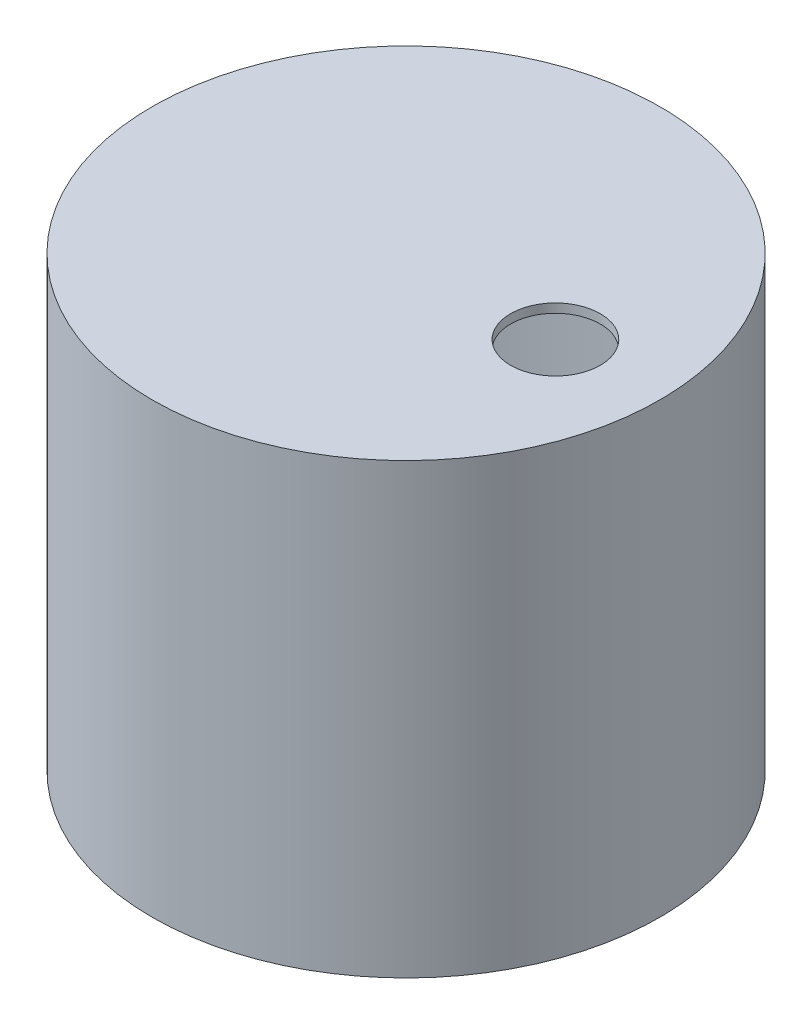
from build123d import *

# Parameters (mm, degrees)
RESERVOIR_WALL_SKETCH_R    = 170
RESERVOIR_WALL_SKETCH_R_2  = 166
RESERVOIR_WALL_SKIRT_DEPTH = 300
RESERVOIR_START            = 40
RESERVOIR_FLOOR_SKETCH_R   = 170
RESERVOIR_FLOOR_SKETCH_R_2 = 10
RESERVOIR_FLOOR_DEPTH      = 6
SEALED_START               = 294
SEALED_LID_SKETCH_R        = 170
SEALED_LID_SKETCH_R_2      = 30
SEALED_LID_DEPTH           = 6


with BuildPart() as part:
    # Reservoir Wall Sketch → Reservoir Wall + Skirt (new body)
    with BuildSketch(Plane(origin=(0, 0, 0), x_dir=(1, 0, 0), z_dir=(0, 1, 0))):
        with Locations(Location((0, 0, 0), (0, 0, 270))):
            Circle(RESERVOIR_WALL_SKETCH_R)
        with Locations(Location((0, 0, 0), (0, 0, 270))):
            Circle(RESERVOIR_WALL_SKETCH_R_2, mode=Mode.SUBTRACT)
    extrude(amount=RESERVOIR_WALL_SKIRT_DEPTH)

    # Reservoir Floor Sketch → Reservoir Floor (add)
    with BuildSketch(Plane(origin=(0, 0, 0), x_dir=(1, 0, 0), z_dir=(0, 1, 0)).offset(RESERVOIR_START)):
        with Locations(Location((0, 0, 0), (0, 0, 270))):
            Circle(RESERVOIR_FLOOR_SKETCH_R)
        with Locations(Location((0, 0, 0), (0, 0, 270))):
            Circle(RESERVOIR_FLOOR_SKETCH_R_2, mode=Mode.SUBTRACT)
    extrude(amount=RESERVOIR_FLOOR_DEPTH)

    # Sealed Lid Sketch → Sealed Lid (add)
    with BuildSketch(Plane(origin=(0, 0, 0), x_dir=(1, 0, 0), z_dir=(0, 1, 0)).offset(SEALED_START)):
        with Locations(Location((0, 0, 0), (0, 0, 270))):
            Circle(SEALED_LID_SKETCH_R)
        with Locations(Location((100, 0, 0), (0, 0, 270))):
            Circle(SEALED_LID_SKETCH_R_2, mode=Mode.SUBTRACT)
    extrude(amount=SEALED_LID_DEPTH)


solid = part.part
